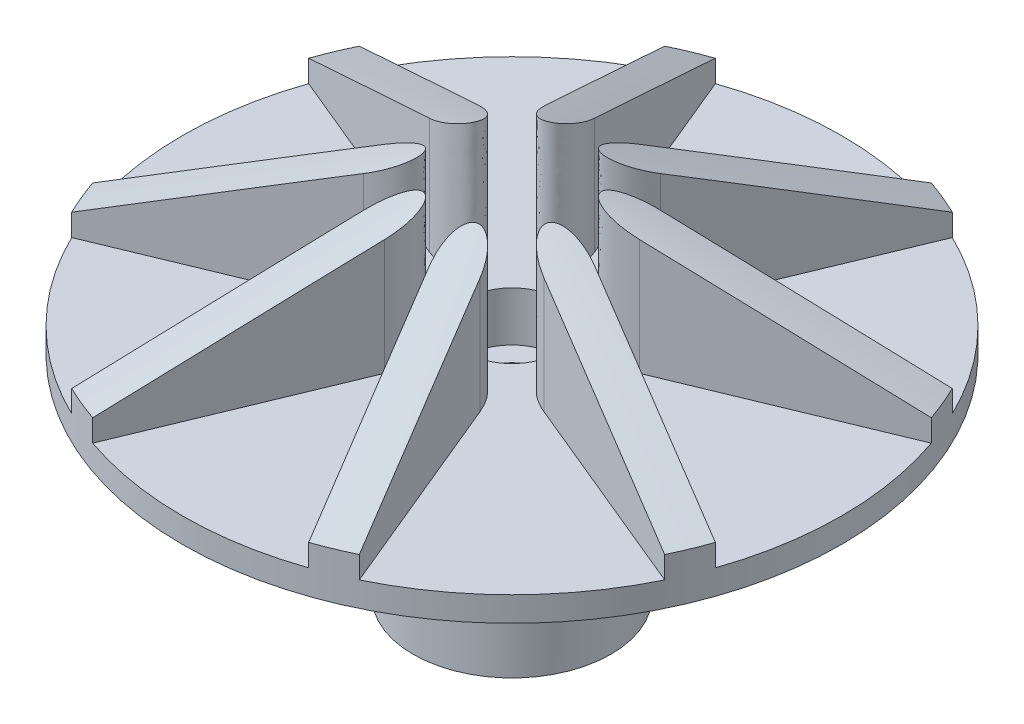
from build123d import *
from build123d.topology import SkipClean

# Parameters (mm, degrees)
SKETCH1_R                       = 26.6319
IMPELLER_PLATE_DEPTH            = 2.000000064
SKETCH6_R                       = 8
BOSS_DEPTH                      = 17.000000036
SKETCH7_R                       = 2.000000064
BOLT_BORE_DEPTH                 = 43.184312238
SKETCH8_R                       = 4
SHAFT_BORE_DEPTH                = 11.999999876
SKETCH9_R                       = 3.75
BOLT_HEAD_BORE_DEPTH            = 4.000000128
SKETCH11_W                      = 12.00000013
SKETCH11_H                      = 2.000000064
DOWEL_SLOT_DEPTH                = 3.000000096
OPENING_START                   = -1
OPENING_ALINGMENT_CUT_DEPTH     = 1
OPENING_ALINGMENT_PATTERN_COUNT = 8
ONE_BLADE_DEPTH                 = 10.746677965
OPENING_START_2                 = -2.000000064
SKETCH15_R                      = 26.6319
SKETCH15_R_2                    = 3.75
OPENING_ALIGNMENT_FILL_DEPTH    = 2.000000064
CIRPATTERN2_COUNT               = 8


with BuildPart() as part:
    # Sketch1 → impeller plate (new body)
    with BuildSketch(Plane(origin=(0, 0, 0), x_dir=(1, 0, 0), z_dir=(0, 1, 0))):
        with Locations(Location((0, 0, 0), (0, 0, 270))):
            Circle(SKETCH1_R)
    extrude(amount=IMPELLER_PLATE_DEPTH)

    # Sketch6 → boss (add)
    with BuildSketch(Plane(origin=(0, 0, 0), x_dir=(-1, 0, 0), z_dir=(0, -1, 0))):
        with Locations(Location((0, 0, 0), (0, 0, 270))):
            Circle(SKETCH6_R)
    extrude(amount=BOSS_DEPTH)

    # Sketch7 → bolt bore (cut, through all)
    with BuildSketch(Plane(origin=(0, -17.000000036, 0), x_dir=(-1, 0, 0), z_dir=(0, -1, 0))):
        with Locations(Location((0, 0, 0), (0, 0, 90))):
            Circle(SKETCH7_R)
    extrude(amount=-BOLT_BORE_DEPTH, mode=Mode.SUBTRACT)

    # Sketch8 → shaft bore (cut)
    with BuildSketch(Plane(origin=(0, -17.000000036, 0), x_dir=(-1, 0, 0), z_dir=(0, -1, 0))):
        with Locations(Location((0, 0, 0), (0, 0, 90))):
            Circle(SKETCH8_R)
    extrude(amount=-SHAFT_BORE_DEPTH, mode=Mode.SUBTRACT)

    # Sketch9 → bolt head bore (cut)
    with BuildSketch(Plane(origin=(0, 2.000000064, 0), x_dir=(1, 0, 0), z_dir=(0, 1, 0))):
        with Locations(Location((0, 0, 0), (0, 0, 270))):
            Circle(SKETCH9_R)
    extrude(amount=-BOLT_HEAD_BORE_DEPTH, mode=Mode.SUBTRACT)

    # Sketch11 → dowel slot (cut)
    with BuildSketch(Plane.XZ.offset(17.000000036)):
        Rectangle(SKETCH11_W, SKETCH11_H)
    extrude(amount=-DOWEL_SLOT_DEPTH, mode=Mode.SUBTRACT)

    # Sketch12 → opening alingment cut (cut)
    with BuildSketch(Plane(origin=(0, 2.000000064, 0), x_dir=(1, 0, 0), z_dir=(0, 1, 0)).offset(OPENING_START)):
        with BuildLine():
            Line((5.228658549, 1.389745954), (26.595614371, 1.389745954))
            ThreePointArc((26.595614371, 1.389745954), (26.6319, 0), (26.595614371, -1.389745954))
            Line((26.595614371, -1.389745954), (5.228658549, -1.389745954))
            ThreePointArc((5.228658549, -1.389745954), (5.4102, 0), (5.228658549, 1.389745954))
        make_face()
    opening_alingment_cut = extrude(amount=OPENING_ALINGMENT_CUT_DEPTH, mode=Mode.SUBTRACT)

    # opening alingment pattern: opening alingment cut ×8 about axis
    opening_alingment_pattern_axis = Axis((0, 0, 0), (0, 1, 0))
    for i in range(1, OPENING_ALINGMENT_PATTERN_COUNT):
        add(opening_alingment_cut.rotate(opening_alingment_pattern_axis, i * 360 / OPENING_ALINGMENT_PATTERN_COUNT), mode=Mode.SUBTRACT)

    # Sketch14 → one blade (add)
    with SkipClean():  # the faces are left unmerged after this step: merging them gives an invalid solid
        with BuildSketch(Plane(origin=(0, 2.000000064, 0), x_dir=(1, 0, 0), z_dir=(0, 1, 0))):
            with BuildLine():
                Line((7.294176633, 4.717477681), (23.962365155, 11.621667427))
                ThreePointArc((23.962365155, 11.621667427), (24.604667322, 10.191586902), (25.161710741, 8.726191048))
                Line((25.161710741, 8.726191048), (8.493522218, 1.822001302))
                add(Edge.make_bspline(
                    [(7.294176633, 4.717477681), (4.398700254, 3.518132095), (4.998373047, 2.070393906), (5.59804584, 0.622655716), (8.493522218, 1.822001302)],
                    knots=[1.570796327, 1.570796327, 1.570796327, 3.141592654, 3.141592654, 4.71238898, 4.71238898, 4.71238898], degree=2, weights=[1, 0.707106781, 1, 0.707106781, 1]))
            make_face()
        one_blade = extrude(amount=ONE_BLADE_DEPTH)

    # Sketch15 → opening alignment fill (add)
    with BuildSketch(Plane(origin=(0, 2.000000064, 0), x_dir=(1, 0, 0), z_dir=(0, 1, 0)).offset(OPENING_START_2)):
        with Locations(Location((0, 0, 0), (0, 0, 25.873230999))):
            Circle(SKETCH15_R)
        with Locations(Location((0, 0, 0), (0, 0, 270))):
            Circle(SKETCH15_R_2, mode=Mode.SUBTRACT)
    extrude(amount=OPENING_ALIGNMENT_FILL_DEPTH)

    # CirPattern2: one blade ×8 about axis
    with SkipClean():  # the faces are left unmerged after this step: merging them gives an invalid solid
        cirpattern2_axis = Axis((0, 0, 0), (0, -1, 0))
        for i in range(1, CIRPATTERN2_COUNT):
            add(one_blade.rotate(cirpattern2_axis, i * 360 / CIRPATTERN2_COUNT))

    # Sketch16 → angle cut (revolve, cut)
    with SkipClean():  # the faces are left unmerged after this step: merging them gives an invalid solid
        with BuildSketch(Plane(origin=(0, 0, 0), x_dir=(0, 0, -1), z_dir=(1, 0, 0)), mode=Mode.PRIVATE) as angle_cut_sk:
            Polygon((5.4102, 12.746678029), (26.6319, 3.778000064), (26.6319, 12.746678029), align=None)
        revolve(angle_cut_sk.sketch.rotate(Axis((0, 0, 0), (0, 1, 0)), 340.873230999), axis=Axis((0, 0, 0), (0, 1, 0)), mode=Mode.SUBTRACT)


solid = part.part
